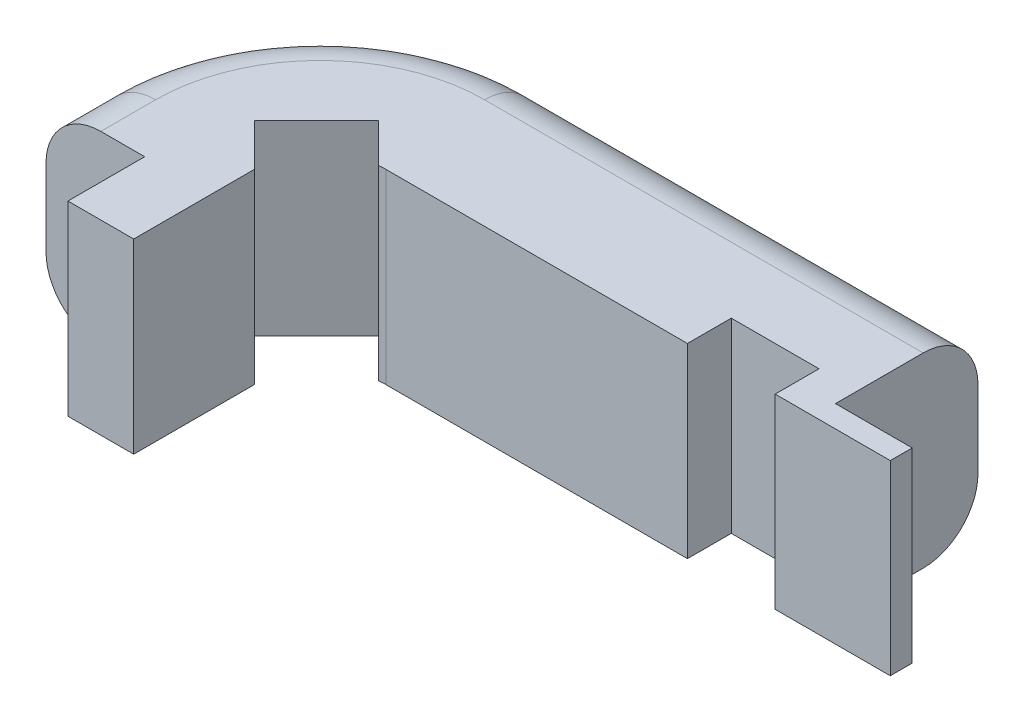
from build123d import *

# Parameters (mm, degrees)
SALIENTE_EXTRUIR1_DEPTH  = 17
CORTAR_EXTRUIR3_DEPTH    = 40
CORTAR_REVOLUCI_N1_ANGLE = 90
CORTAR_EXTRUIR4_DEPTH    = 10
CORTAR_EXTRUIR5_DEPTH    = 27
CROQUIS15_W              = 6
CROQUIS15_H              = 17
SALIENTE_EXTRUIR2_DEPTH  = 7
CROQUIS16_W              = 2
CROQUIS16_H              = 17
SALIENTE_EXTRUIR3_DEPTH  = 7
CORTAR_EXTRUIR6_START    = -23
CROQUIS17_W              = 8
CROQUIS17_H              = 4
CORTAR_EXTRUIR6_DEPTH    = 23


with BuildPart() as part:
    # Croquis1 → Saliente-Extruir1 (new body)
    with BuildSketch(Plane(origin=(0, 0, 0), x_dir=(1, 0, 0), z_dir=(0, 1, 0))):
        with BuildLine():
            Line((0, 0), (-40, 0))
            ThreePointArc((-40, 0), (-54.142135624, -5.857864376), (-60, -20))
            Line((-60, -20), (-60, -25))
            Line((-60, -25), (0, -25))
            Line((0, -25), (0, 0))
        make_face()
    extrude(amount=SALIENTE_EXTRUIR1_DEPTH)

    # Croquis8 → Cortar-Extruir3 (cut)
    with BuildSketch(Plane(origin=(0, 0, 0), x_dir=(0, 0, -1), z_dir=(1, 0, 0))):
        with BuildLine():
            Line((-5, 0), (0, 0))
            Line((0, 0), (0, 5))
            ThreePointArc((0, 5), (-1.464466094, 1.464466094), (-5, 0))
        make_face()
        with BuildLine():
            Line((0, 12), (0, 17))
            Line((0, 17), (-5, 17))
            ThreePointArc((-5, 17), (-1.464466094, 15.535533906), (0, 12))
        make_face()
    extrude(amount=-CORTAR_EXTRUIR3_DEPTH, mode=Mode.SUBTRACT)

    # Croquis13 → Cortar-Revolución1 (revolve, cut)
    with BuildSketch(Plane(origin=(-40, 0, 0), x_dir=(0, 0, -1), z_dir=(1, 0, 0))):
        with BuildLine():
            Line((-5, 17), (0, 17))
            Line((0, 17), (0, 12))
            ThreePointArc((0, 12), (-1.464466094, 15.535533906), (-5, 17))
        make_face()
        with BuildLine():
            Line((0, 5), (0, 0))
            Line((0, 0), (-5, 0))
            ThreePointArc((-5, 0), (-1.464466094, 1.464466094), (0, 5))
        make_face()
    revolve(axis=Axis((-40, 22.120784126, 20), (0, 1, 0)), revolution_arc=CORTAR_REVOLUCI_N1_ANGLE, mode=Mode.SUBTRACT)

    # Croquis14 → Cortar-Extruir4 (cut)
    with BuildSketch(Plane(origin=(0, 0, 20), x_dir=(-1, 0, 0), z_dir=(0, 0, -1))):
        with BuildLine():
            Line((55, 17), (60, 17))
            Line((60, 17), (60, 12))
            ThreePointArc((60, 12), (58.535533906, 15.535533906), (55, 17))
        make_face()
        with BuildLine():
            Line((60, 5), (60, 0))
            Line((60, 0), (55, 0))
            ThreePointArc((55, 0), (58.535533906, 1.464466094), (60, 5))
        make_face()
    extrude(amount=-CORTAR_EXTRUIR4_DEPTH, mode=Mode.SUBTRACT)

    # Croquis12 → Cortar-Extruir5 (cut)
    with BuildSketch(Plane(origin=(0, 17, 0), x_dir=(1, 0, 0), z_dir=(0, 1, 0))):
        with BuildLine():
            Line((0, -15), (-39, -15))
            ThreePointArc((-39, -15), (-43.242640687, -16.757359313), (-45, -21))
            Line((-45, -21), (-45, -25))
            Line((-45, -25), (0, -25))
            Line((0, -25), (0, -15))
        make_face()
    extrude(amount=-CORTAR_EXTRUIR5_DEPTH, mode=Mode.SUBTRACT)

    # Croquis15 → Saliente-Extruir2 (add)
    with BuildSketch(Plane.XY.offset(25)):
        with Locations((-48, 8.5)):
            Rectangle(CROQUIS15_W, CROQUIS15_H)
    extrude(amount=SALIENTE_EXTRUIR2_DEPTH)

    # Croquis16 → Saliente-Extruir3 (add)
    with BuildSketch(Plane(origin=(0, 0, 0), x_dir=(0, 0, -1), z_dir=(1, 0, 0))):
        with Locations((-14, 8.5)):
            Rectangle(CROQUIS16_W, CROQUIS16_H)
    extrude(amount=SALIENTE_EXTRUIR3_DEPTH)

    # Croquis17 → Cortar-Extruir6 (cut)
    with BuildSketch(Plane.XZ.offset(CORTAR_EXTRUIR6_START)):
        with Locations((-7.5, 13)):
            Rectangle(CROQUIS17_W, CROQUIS17_H)
        with BuildLine():
            Line((-45, 21), (-48.843271123, 17.156728877))
            Line((-48.843271123, 17.156728877), (-43.186416873, 11.499874628))
            Line((-43.186416873, 11.499874628), (-39.650882968, 15.035408533))
            ThreePointArc((-39.650882968, 15.035408533), (-43.466838804, 16.994085486), (-45, 21))
        make_face()
    extrude(amount=CORTAR_EXTRUIR6_DEPTH, mode=Mode.SUBTRACT)


solid = part.part
